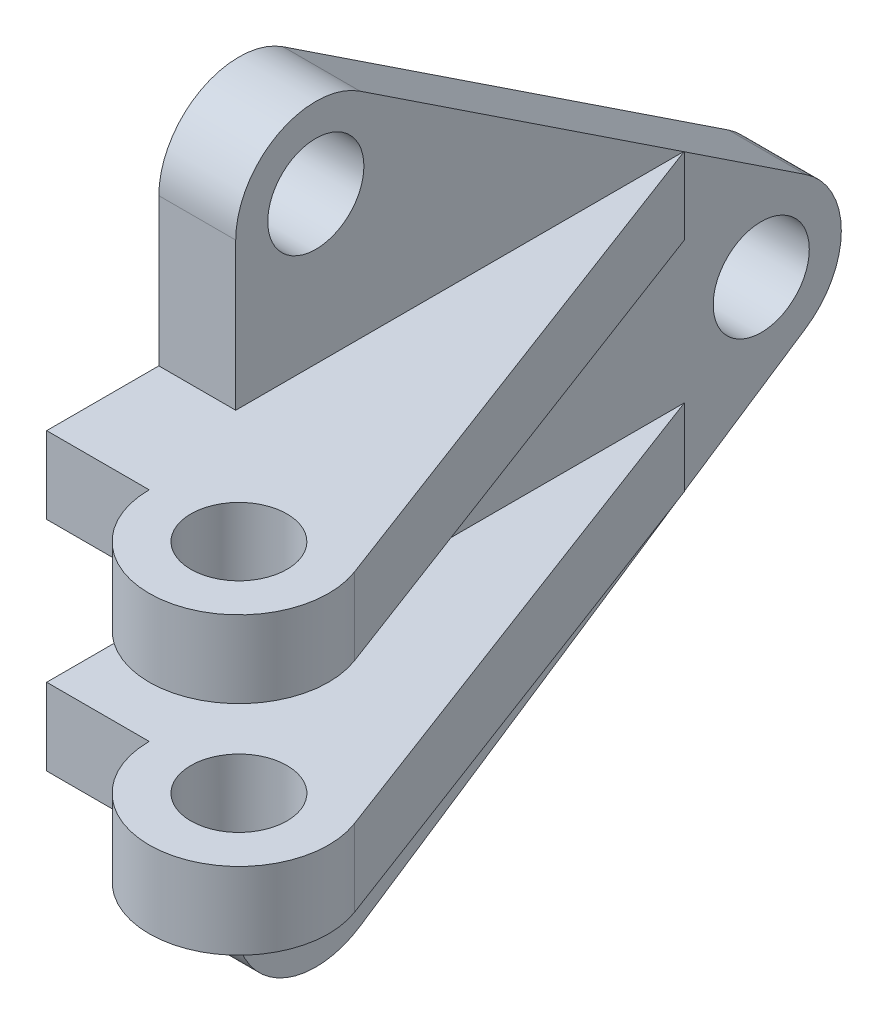
from build123d import *

# Parameters (mm, degrees)
SKETCH1_R               = 7.5
BOSS_EXTRUDE1_DEPTH     = 12
SKETCH2_R               = 7.5
BOSS_EXTRUDE2_DEPTH     = 23
CUT_EXTRUDE1_REACH      = 132.347
SKETCH3_W               = 44
SKETCH3_H               = 22
CUT_EXTRUDE2_DEPTH      = 116.656819946
CUT_EXTRUDE2_DEPTH_BACK = 116.656819946
SKETCH4_W               = 28
SKETCH4_H               = 22
CUT_EXTRUDE3_DEPTH      = 116.656819946
CUT_EXTRUDE3_DEPTH_BACK = 116.656819946
SKETCH5_W               = 4
SKETCH5_H               = 22


with BuildPart() as part:
    # Sketch1 → Boss-Extrude1 (new body)
    with BuildSketch(Plane.YZ):
        with BuildLine():
            Line((-46, 82), (46, 82))
            ThreePointArc((46, 82), (57.011103253, 75.416553486), (56.423645014, 62.600896825))
            Line((56.423645014, 62.600896825), (10.423645014, -6.899103175))
            ThreePointArc((10.423645014, -6.899103175), (0, -12.5), (-10.423645014, -6.899103175))
            Line((-10.423645014, -6.899103175), (-56.423645014, 62.600896825))
            ThreePointArc((-56.423645014, 62.600896825), (-57.011103253, 75.416553486), (-46, 82))
        make_face()
        with Locations(Location((0, 0, 0), (0, 0, 270))):
            Circle(SKETCH1_R, mode=Mode.SUBTRACT)
        with Locations(Location((46, 69.5, 0), (0, 0, 270))):
            Circle(SKETCH1_R, mode=Mode.SUBTRACT)
        with Locations(Location((-46, 69.5, 0), (0, 0, 90))):
            Circle(SKETCH1_R, mode=Mode.SUBTRACT)
    extrude(amount=-BOSS_EXTRUDE1_DEPTH)

    # Sketch2 → Boss-Extrude2 (add, symmetric)
    with BuildSketch(Plane(origin=(0, 0, 0), x_dir=(-1, 0, 0), z_dir=(0, 1, 0))):
        with BuildLine():
            Line((12, 99.5), (-4, 99.5))
            ThreePointArc((-4, 99.5), (-20.50814275, 113.273497012), (-31.101317135, 94.564871904))
            Line((-31.101317135, 94.564871904), (0, 12))
            Line((0, 12), (0, 82))
            Line((0, 82), (12, 82))
            Line((12, 82), (12, 99.5))
        make_face()
        with Locations(Location((-18, 99.5, 0), (0, 0, 90))):
            Circle(SKETCH2_R, mode=Mode.SUBTRACT)
    extrude(amount=BOSS_EXTRUDE2_DEPTH, both=True)

    # Cut-Extrude1: up to this face of the body (flat: up to its plane)
    cut_extrude1_end = Plane(part.part.faces().sort_by_distance((-6, -34.5, 82))[0])
    # Sketch3 → Cut-Extrude1 (cut, up to the picked face)
    with BuildSketch(Plane.XY.offset(99.5), mode=Mode.PRIVATE) as cut_extrude1_sk1:
        with Locations((10, 0)):
            Rectangle(SKETCH3_W, SKETCH3_H)
    cut_extrude1_tool1 = split(extrude(cut_extrude1_sk1.sketch, amount=-CUT_EXTRUDE1_REACH, mode=Mode.PRIVATE), bisect_by=cut_extrude1_end, keep=Keep.BOTH, mode=Mode.PRIVATE)
    add(cut_extrude1_tool1.solids().sort_by(Axis((10, 0, 99.5), (0, 0, -1)))[0], mode=Mode.SUBTRACT)

    # Sketch4 → Cut-Extrude2 (cut, two sides: drawn at the far end of the back side and taken through both)
    with BuildSketch(Plane.XY.offset(82).offset(-CUT_EXTRUDE2_DEPTH_BACK)):
        with Locations((18, 0)):
            Rectangle(SKETCH4_W, SKETCH4_H)
    extrude(amount=CUT_EXTRUDE2_DEPTH + CUT_EXTRUDE2_DEPTH_BACK, mode=Mode.SUBTRACT)

    # Sketch5 → Cut-Extrude3 (cut, two sides: drawn at the far end of the back side and taken through both)
    with BuildSketch(Plane.XY.offset(82).offset(-CUT_EXTRUDE3_DEPTH_BACK)):
        with Locations((2, 0)):
            Rectangle(SKETCH5_W, SKETCH5_H)
    extrude(amount=CUT_EXTRUDE3_DEPTH + CUT_EXTRUDE3_DEPTH_BACK, mode=Mode.SUBTRACT)


solid = part.part
